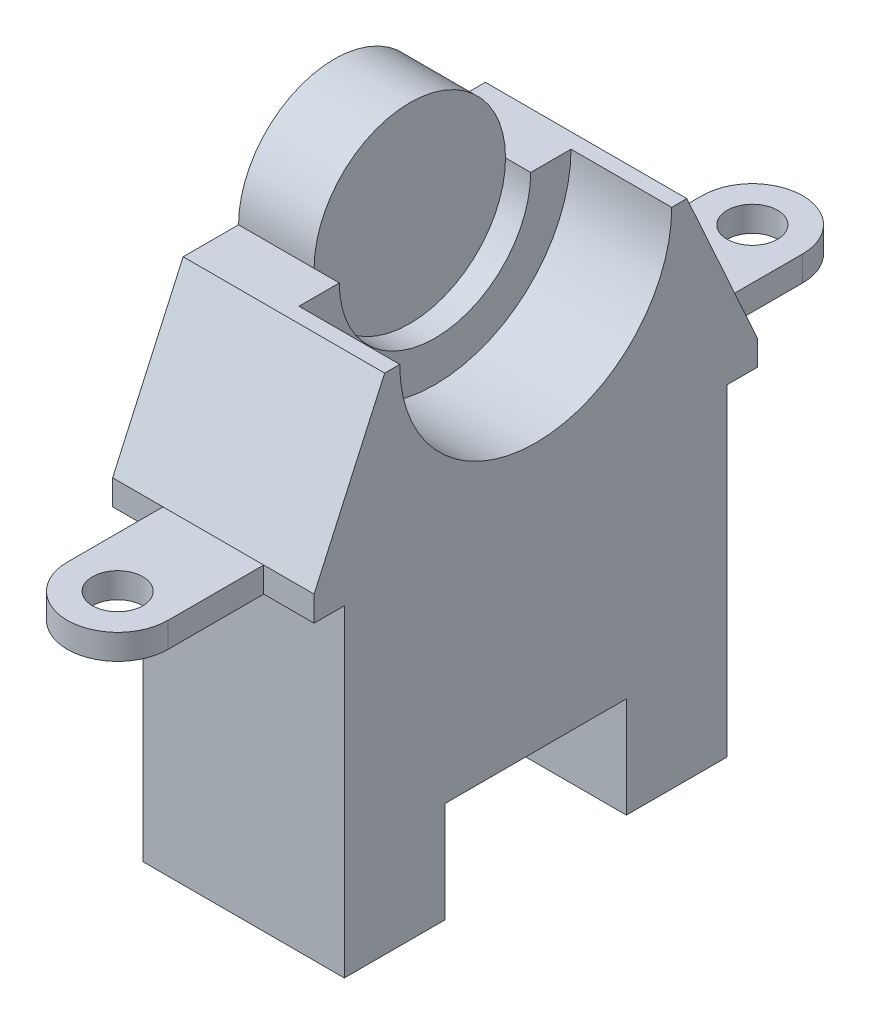
from build123d import *

# Parameters (mm, degrees)
BOSS_EXTRUDE1_DEPTH = 20
HOLE1_D             = 38
HOLE1_DEPTH         = 100
HOLE1_CBORE_D       = 54
HOLE1_CBORE_DEPTH   = 20
HOLE1_TIP           = 11.416351762
SKETCH4_R           = 19
BOSS_EXTRUDE2_DEPTH = 15
SKETCH5_R           = 5
BOSS_EXTRUDE3_DEPTH = 5


with BuildPart() as part:
    # Sketch1 → Boss-Extrude1 (new, symmetric)
    with BuildSketch(Plane(origin=(0, 0, 0), x_dir=(0, 0, -1), z_dir=(1, 0, 0))):
        Polygon((-38, 0), (-38, 64), (-44, 64), (-44, 69), (-30, 100), (30, 100), (44, 69), (44, 64), (38, 64), (38, 0), (18, 0), (18, 20), (-18, 20), (-18, 0), align=None)
    extrude(amount=BOSS_EXTRUDE1_DEPTH, both=True)

    # Hole1
    with Locations(Plane(origin=(20, 0, 0), x_dir=(0, 0, -1), z_dir=(1, 0, 0))):
        with Locations((0, 100)):
            CounterBoreHole(HOLE1_D / 2, HOLE1_CBORE_D / 2, HOLE1_CBORE_DEPTH, depth=HOLE1_DEPTH)
            with Locations((0, 0, -(HOLE1_DEPTH + HOLE1_TIP / 2))):  # 118° drill point
                Cone(0, HOLE1_D / 2, HOLE1_TIP, mode=Mode.SUBTRACT)

    # Sketch4 → Boss-Extrude2 (add)
    with BuildSketch(Plane.ZY.offset(20)):
        with Locations((0, 100)):
            Circle(SKETCH4_R)
    extrude(amount=-BOSS_EXTRUDE2_DEPTH)

    # Sketch5 → Boss-Extrude3 (add)
    with BuildSketch(Plane(origin=(0, 69, 0), x_dir=(1, 0, 0), z_dir=(0, 1, 0))):
        with BuildLine():
            Line((-10, 63), (-10, 44))
            Line((-10, 44), (10, 44))
            Line((10, 44), (10, 63))
            ThreePointArc((10, 63), (0, 73), (-10, 63))
        make_face()
        with Locations(Location((0, 63, 0), (0, 0, 270))):
            Circle(SKETCH5_R, mode=Mode.SUBTRACT)
    boss_extrude3 = extrude(amount=-BOSS_EXTRUDE3_DEPTH)

    # Mirror1: Boss-Extrude3 across plane
    add(boss_extrude3.mirror(Plane.XY))


solid = part.part
